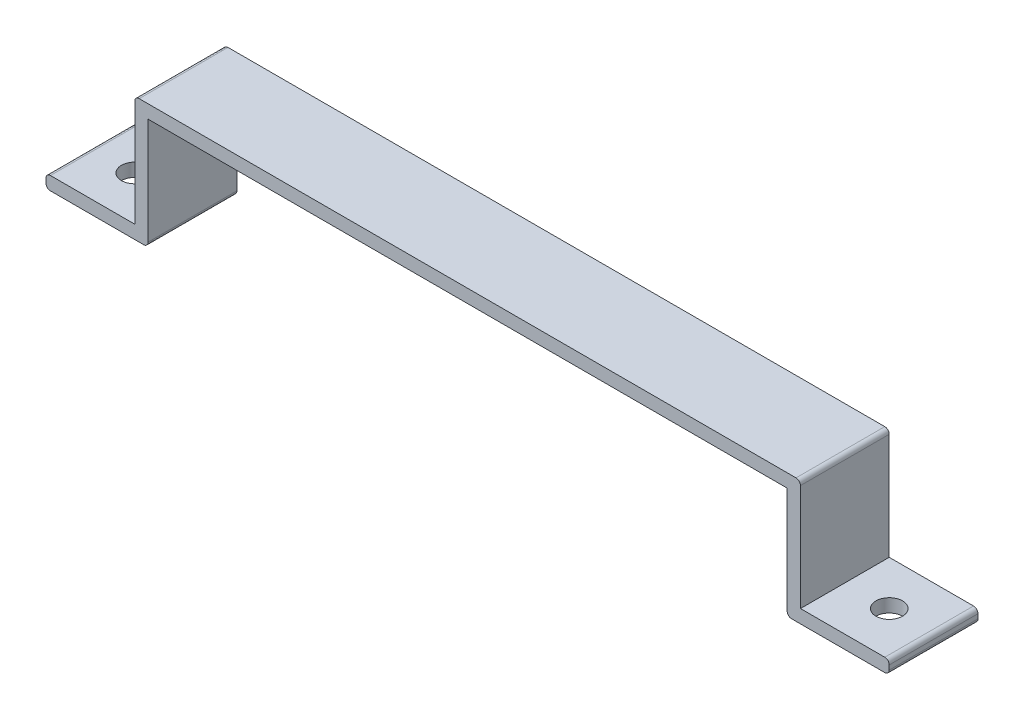
from build123d import *

# Parameters (mm, degrees)
EXTRUDE_THIN1_DEPTH = 20
FILLET1_R           = 1
CUT_EXTRUDE1_REACH  = 194.678
SKETCH2_R           = 3


with BuildPart() as part:
    # Sketch1 → Extrude-Thin1 (new body)
    with BuildSketch(Plane.XY):
        Polygon((0, 0), (20, 0), (20, 25), (170, 25), (170, 0), (190, 0), (190, -3), (167, -3), (167, 22), (23, 22), (23, -3), (0, -3), align=None)
    extrude(amount=EXTRUDE_THIN1_DEPTH)

    # Fillet1
    fillet1_edges = [part.edges().sort_by_distance(p)[0] for p in [
        (167, -3, 10),
        (23, -3, 10),
        (0, -3, 10),
        (0, 0, 10),
        (20, 25, 10),
        (170, 25, 10),
        (190, 0, 10),
        (190, -3, 10),
    ]]
    fillet(fillet1_edges, radius=FILLET1_R)

    # Sketch2 → Cut-Extrude1 (cut, up to next)
    with BuildSketch(Plane(origin=(0, 0, 0), x_dir=(1, 0, 0), z_dir=(0, 1, 0)), mode=Mode.PRIVATE) as cut_extrude1_sk1:
        with Locations(Location((10, -10, 0), (0, 0, 270))):
            Circle(SKETCH2_R)
    cut_extrude1_tool1 = extrude(cut_extrude1_sk1.sketch, amount=-CUT_EXTRUDE1_REACH, mode=Mode.PRIVATE) & part.part
    # Sketch2 → Cut-Extrude1 (cut, up to next)
    with BuildSketch(Plane(origin=(0, 0, 0), x_dir=(1, 0, 0), z_dir=(0, 1, 0)), mode=Mode.PRIVATE) as cut_extrude1_sk2:
        with Locations(Location((180, -10, 0), (0, 0, 270))):
            Circle(SKETCH2_R)
    cut_extrude1_tool2 = extrude(cut_extrude1_sk2.sketch, amount=-CUT_EXTRUDE1_REACH, mode=Mode.PRIVATE) & part.part
    add(cut_extrude1_tool1.solids().sort_by_distance((10, 0, 10))[0], mode=Mode.SUBTRACT)
    add(cut_extrude1_tool2.solids().sort_by_distance((180, 0, 10))[0], mode=Mode.SUBTRACT)


solid = part.part
